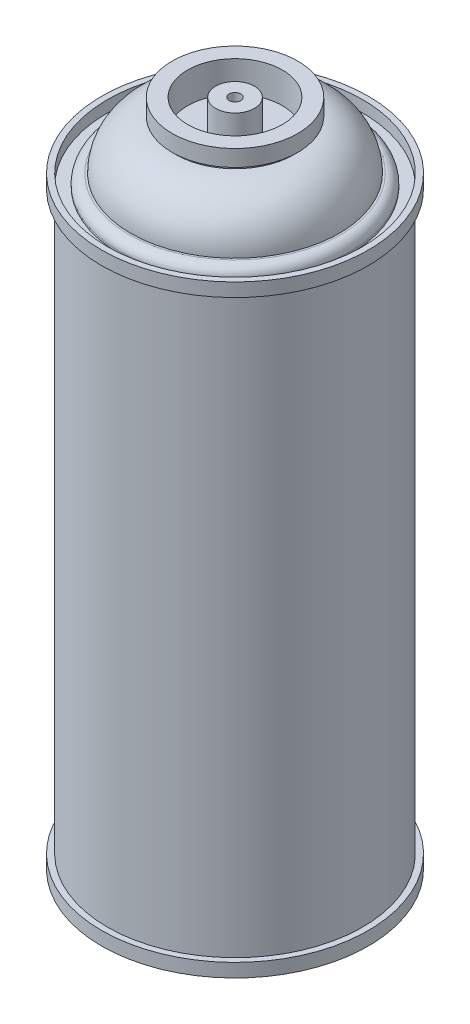
from build123d import *

# Parameters (mm, degrees)
SKETCH1_R           = 33
BOSS_EXTRUDE1_DEPTH = 156
SKETCH3_R           = 34.5
BOSS_EXTRUDE2_DEPTH = 3.5
LPATTERN1_COUNT     = 2
LPATTERN1_PITCH     = 152.5
SKETCH6_R           = 1.5
CUT_EXTRUDE1_DEPTH  = 6
CUT_EXTRUDE2_START  = -3
SKETCH7_R           = 33
SKETCH7_R_2         = 30
CUT_EXTRUDE2_DEPTH  = 3
FILLET1_R           = 2.5


with BuildPart() as part:
    # Sketch1 → Boss-Extrude1 (new body)
    with BuildSketch(Plane(origin=(0, 0, 0), x_dir=(1, 0, 0), z_dir=(0, 1, 0))):
        with Locations(Location((0, 0, 0), (0, 0, 270))):
            Circle(SKETCH1_R)
    extrude(amount=BOSS_EXTRUDE1_DEPTH)

    # Sketch2 → Revolve1 (revolve)
    with BuildSketch(Plane(origin=(0, 0, 0), x_dir=(0, 0, -1), z_dir=(1, 0, 0)), mode=Mode.PRIVATE) as revolve1_sk:
        with BuildLine():
            Line((15.25, 167.75), (15.25, 168.75))
            Line((15.25, 168.75), (16.25, 168.75))
            Line((16.25, 168.75), (16.25, 173))
            Line((16.25, 173), (12.25, 173))
            Line((12.25, 173), (12.25, 165))
            Line((12.25, 165), (5, 165))
            Line((5, 165), (5, 173))
            Line((5, 173), (0, 173))
            Line((0, 173), (0, 156))
            Line((0, 156), (27, 156))
            ThreePointArc((27, 156), (23.558504679, 164.308504679), (15.25, 167.75))
        make_face()
    revolve(revolve1_sk.sketch.rotate(Axis((0, 173, 0), (0, -1, 0)), 180), axis=Axis((0, 173, 0), (0, -1, 0)))

    # Sketch3 → Boss-Extrude2 (add)
    with BuildSketch(Plane(origin=(0, 156, 0), x_dir=(1, 0, 0), z_dir=(0, 1, 0))):
        with Locations(Location((0, 0, 0), (0, 0, 270))):
            Circle(SKETCH3_R)
    boss_extrude2 = extrude(amount=-BOSS_EXTRUDE2_DEPTH)

    # LPattern1: Boss-Extrude2 ×2
    with Locations(*[(0, -i * LPATTERN1_PITCH, 0) for i in range(1, LPATTERN1_COUNT)]):
        add(boss_extrude2)

    # Sketch5 → Cut-Revolve1 (revolve, cut)
    with BuildSketch(Plane.XY, mode=Mode.PRIVATE) as cut_revolve1_sk:
        with BuildLine():
            Line((0, 0), (-32.5, 0))
            ThreePointArc((-32.5, 0), (-17.322312201, 8.904178879), (0, 12))
            Line((0, 12), (0, 0))
        make_face()
    revolve(cut_revolve1_sk.sketch.rotate(Axis((0, 12, 0), (0, -1, 0)), 180), axis=Axis((0, 12, 0), (0, -1, 0)), mode=Mode.SUBTRACT)

    # Sketch6 → Cut-Extrude1 (cut)
    with BuildSketch(Plane(origin=(0, 173, 0), x_dir=(1, 0, 0), z_dir=(0, 1, 0))):
        with Locations(Location((0, 0, 0), (0, 0, 270))):
            Circle(SKETCH6_R)
    extrude(amount=-CUT_EXTRUDE1_DEPTH, mode=Mode.SUBTRACT)

    # Sketch7 → Cut-Extrude2 (cut)
    with BuildSketch(Plane(origin=(0, 156, 0), x_dir=(1, 0, 0), z_dir=(0, 1, 0)).offset(CUT_EXTRUDE2_START)):
        with Locations(Location((0, 0, 0), (0, 0, 270))):
            Circle(SKETCH7_R)
        with Locations(Location((0, 0, 0), (0, 0, 270))):
            Circle(SKETCH7_R_2, mode=Mode.SUBTRACT)
    extrude(amount=CUT_EXTRUDE2_DEPTH, mode=Mode.SUBTRACT)

    # Fillet1
    fillet1_edges = [part.edges().sort_by_distance(p)[0] for p in [
        (0, 156, -30),
    ]]
    fillet(fillet1_edges, radius=FILLET1_R)


solid = part.part
